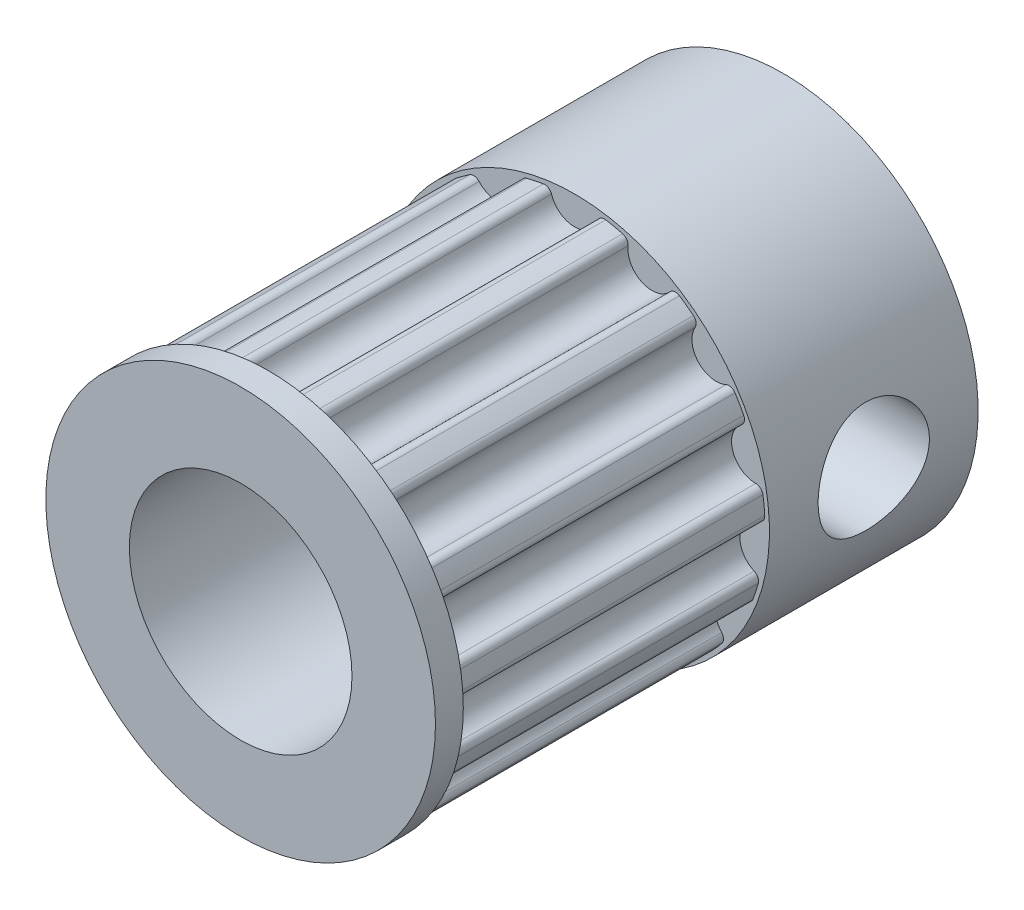
from build123d import *

# Parameters (mm, degrees)
SKETCH1_R           = 6.843972439
BOSS_EXTRUDE1_DEPTH = 5.5
CUT_EXTRUDE1_DEPTH  = 15.65195951
CIRPATTERN1_COUNT   = 15
SKETCH3_R           = 7
BOSS_EXTRUDE2_DEPTH = 1
BOSS_EXTRUDE3_START = 7.5
SKETCH4_R           = 7
BOSS_EXTRUDE3_DEPTH = 7.5
SKETCH5_R           = 4
CUT_EXTRUDE2_DEPTH  = 22.868927729
SKETCH6_R           = 2
CUT_EXTRUDE3_DEPTH  = 17.340134638
CIRPATTERN2_COUNT   = 2
CIRPATTERN2_ANGLE   = 90


with BuildPart() as part:
    # Sketch1 → Boss-Extrude1 (new, symmetric)
    with BuildSketch(Plane.XY):
        Circle(SKETCH1_R)
    extrude(amount=BOSS_EXTRUDE1_DEPTH, both=True)

    # Sketch2 → Cut-Extrude1 (cut, through all)
    with BuildSketch(Plane.XY.offset(5.5)):
        with BuildLine():
            ThreePointArc((-1.117417151, 6.752135785), (-0.9397987, 6.71772722), (-0.827629371, 6.57577545))
            ThreePointArc((-0.827629371, 6.57577545), (0, 5.973972439), (0.827629371, 6.57577545))
            ThreePointArc((0.827629371, 6.57577545), (0.9397987, 6.71772722), (1.117417151, 6.752135785))
            ThreePointArc((1.117417151, 6.752135785), (0, 6.843972439), (-1.117417151, 6.752135785))
        make_face()
    cut_extrude1 = extrude(amount=-CUT_EXTRUDE1_DEPTH, mode=Mode.SUBTRACT)

    # CirPattern1: Cut-Extrude1 ×15 about axis
    cirpattern1_axis = Axis((0, 0, 0), (0, 0, 1))
    for i in range(1, CIRPATTERN1_COUNT):
        add(cut_extrude1.rotate(cirpattern1_axis, i * 360 / CIRPATTERN1_COUNT), mode=Mode.SUBTRACT)

    # Sketch3 → Boss-Extrude2 (add)
    with BuildSketch(Plane.XY.offset(5.5)):
        Circle(SKETCH3_R)
    extrude(amount=BOSS_EXTRUDE2_DEPTH)

    # Sketch4 → Boss-Extrude3 (add)
    with BuildSketch(Plane(origin=(0, 0, -5.5), x_dir=(-1, 0, 0), z_dir=(0, 0, -1)).offset(BOSS_EXTRUDE3_START)):
        with Locations(Location((0, 0, 0), (0, 0, 180))):
            Circle(SKETCH4_R)
    extrude(amount=-BOSS_EXTRUDE3_DEPTH)

    # Sketch5 → Cut-Extrude2 (cut, through all)
    with BuildSketch(Plane.XY.offset(6.5)):
        Circle(SKETCH5_R)
    extrude(amount=-CUT_EXTRUDE2_DEPTH, mode=Mode.SUBTRACT)

    # Sketch6 → Cut-Extrude3 (cut, through all)
    with BuildSketch(Plane(origin=(0, 0, 0), x_dir=(0, 0, -1), z_dir=(1, 0, 0))):
        with Locations(Location((9.25, 0, 0), (0, 0, 180))):
            Circle(SKETCH6_R)
    cut_extrude3 = extrude(amount=CUT_EXTRUDE3_DEPTH, mode=Mode.SUBTRACT)

    # CirPattern2: Cut-Extrude3 ×2 about axis
    cirpattern2_axis = Axis((0, 0, -13), (0, 0, -1))
    for i in range(1, CIRPATTERN2_COUNT):
        add(cut_extrude3.rotate(cirpattern2_axis, i * CIRPATTERN2_ANGLE / (CIRPATTERN2_COUNT - 1)), mode=Mode.SUBTRACT)


solid = part.part
